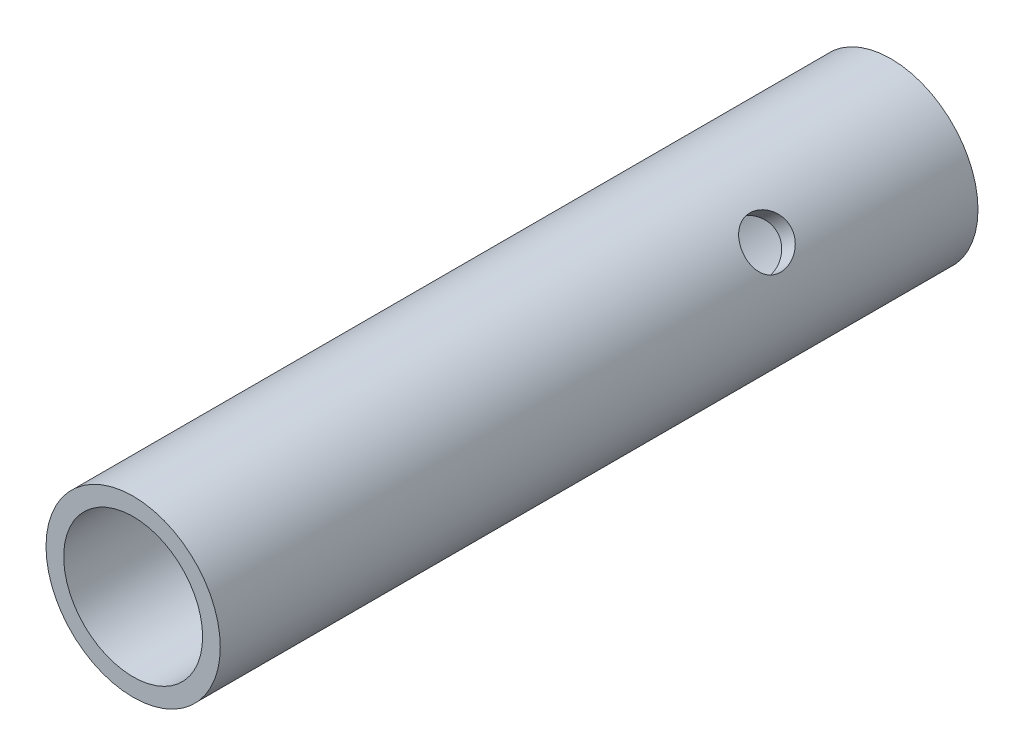
from build123d import *

# Parameters (mm, degrees)
SKETCH3_R           = 17.526
SKETCH3_R_2         = 13.97
BOSS_EXTRUDE1_DEPTH = 76.2
SKETCH5_R           = 4.7625
CUT_EXTRUDE1_DEPTH  = 245.925020099


with BuildPart() as part:
    # Sketch3 → Boss-Extrude1 (new, symmetric)
    with BuildSketch(Plane.XY):
        with Locations(Location((0, 0, 0), (0, 0, 180))):
            Circle(SKETCH3_R)
        with Locations(Location((0, 0, 0), (0, 0, 180))):
            Circle(SKETCH3_R_2, mode=Mode.SUBTRACT)
    extrude(amount=BOSS_EXTRUDE1_DEPTH, both=True)

    # Sketch5 → Cut-Extrude1 (cut, through all)
    with BuildSketch(Plane(origin=(-33.800045171, -28.867965748, -158.75), x_dir=(-0.6494480483301873, 0.7604059656000278, 0), z_dir=(-0.7604059656000278, -0.6494480483301873, 0))):
        with Locations(Location((0, -120.65, 0), (0, 0, 180))):
            Circle(SKETCH5_R)
    extrude(amount=-CUT_EXTRUDE1_DEPTH, mode=Mode.SUBTRACT)


solid = part.part
